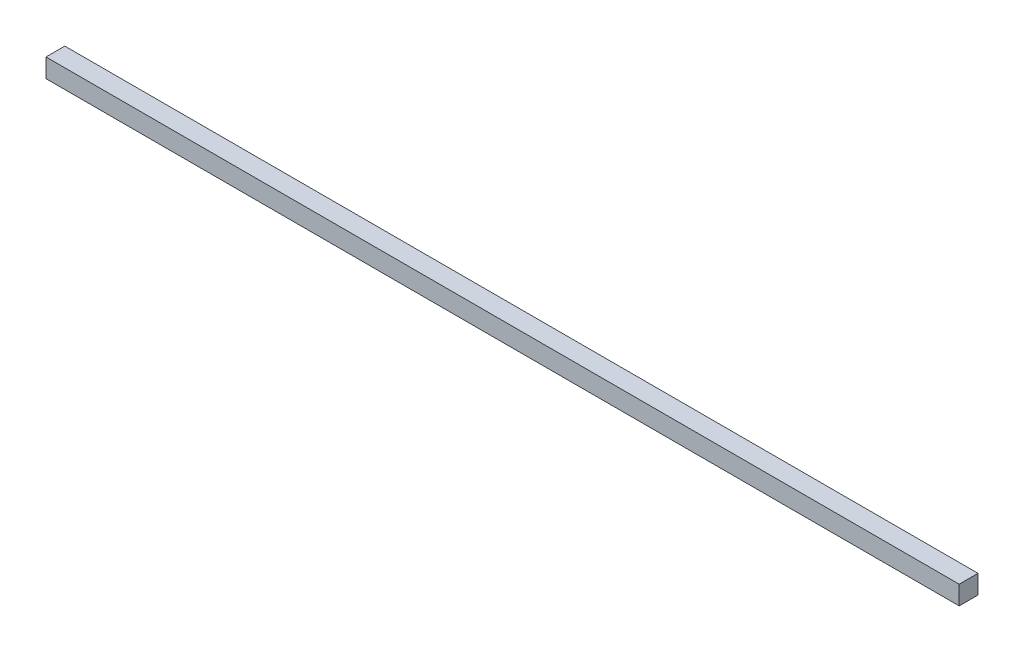
from build123d import *

# Parameters (mm, degrees)
SKETCH1_W           = 6.35
SKETCH1_H           = 6.35
BOSS_EXTRUDE1_DEPTH = 307.975


with BuildPart() as part:
    # Sketch1 → Boss-Extrude1 (new body)
    with BuildSketch(Plane(origin=(0, 0, 0), x_dir=(0, 0, -1), z_dir=(1, 0, 0))):
        with Locations((3.175, 3.175)):
            Rectangle(SKETCH1_W, SKETCH1_H)
    extrude(amount=BOSS_EXTRUDE1_DEPTH)


solid = part.part
